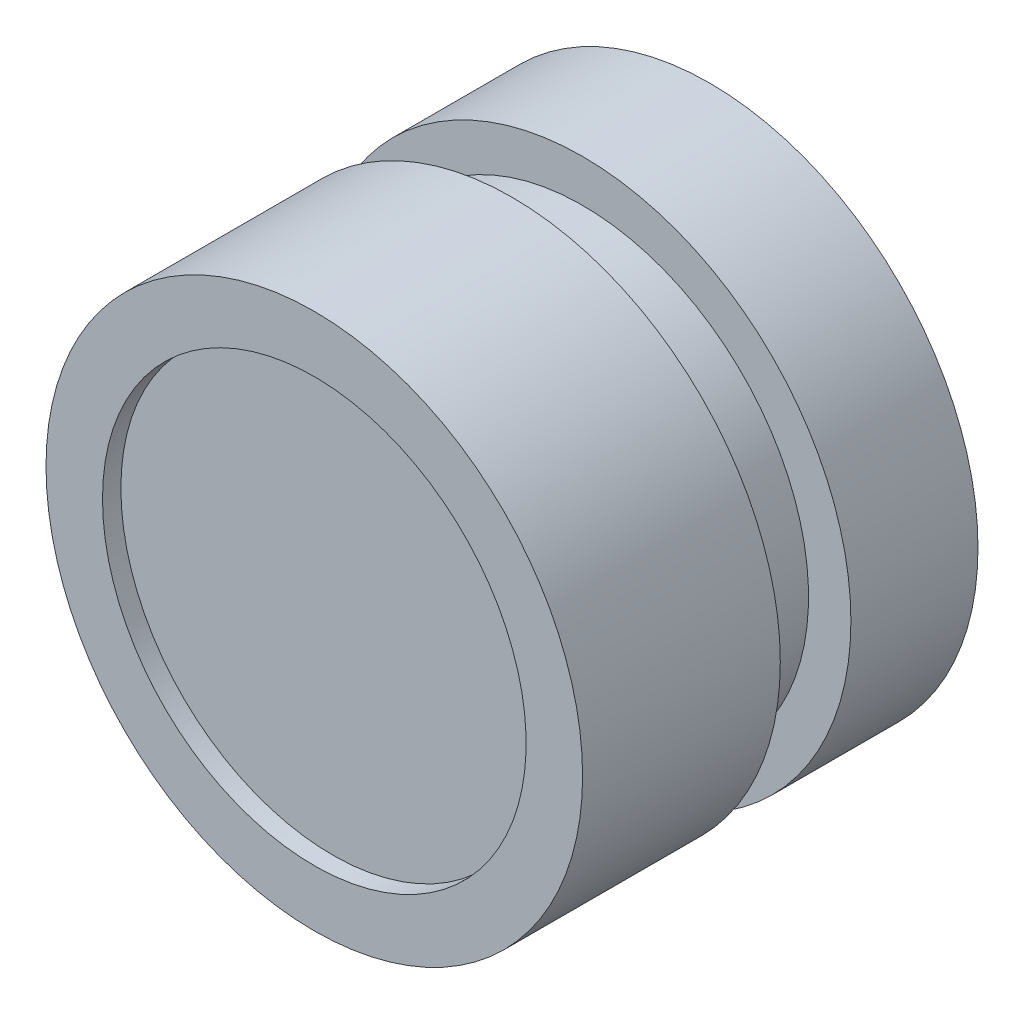
from build123d import *


with BuildPart() as part:
    # Эскиз2 → Повернуть1 (revolve)
    with BuildSketch(Plane(origin=(0, 0, 0), x_dir=(1, 0, 0), z_dir=(0, 1, 0)), mode=Mode.PRIVATE) as revolve_1_sk:
        Polygon((0, 14), (0, 0.650885227), (7.5, 0.650885227), (7.5, 0), (9.5, 0), (9.5, 7), (8, 7), (8, 9.5), (9.5, 9.5), (9.5, 14), align=None)
    revolve(revolve_1_sk.sketch.rotate(Axis((0, 0, -14), (0, 0, 1)), 180), axis=Axis((0, 0, -14), (0, 0, 1)))


solid = part.part
